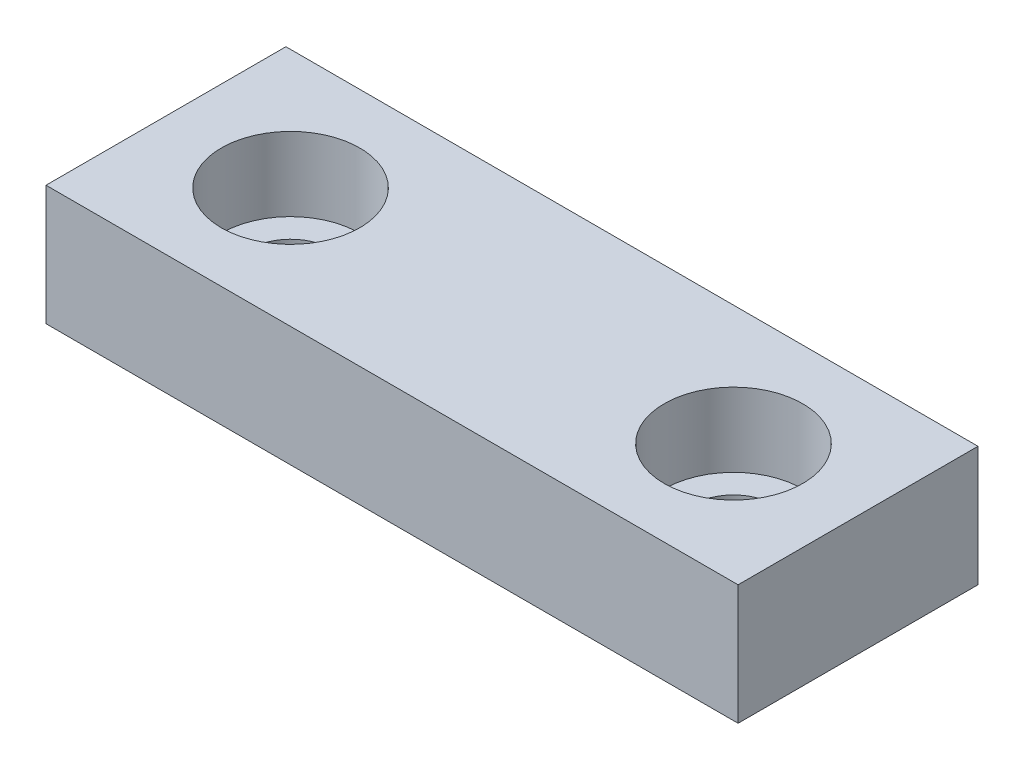
from build123d import *

# Parameters (mm, degrees)
SKETCH1_W                      = 75
SKETCH1_H                      = 26
EXTRUDE1_DEPTH                 = 13
CBORE_FOR_M8_SHCS1_D           = 9
CBORE_FOR_M8_SHCS1_CBORE_D     = 15
CBORE_FOR_M8_SHCS1_CBORE_DEPTH = 8


with BuildPart() as part:
    # Sketch1 → Extrude1 (new body)
    with BuildSketch(Plane(origin=(0, 0, 0), x_dir=(1, 0, 0), z_dir=(0, 1, 0))):
        Rectangle(SKETCH1_W, SKETCH1_H)
    extrude(amount=EXTRUDE1_DEPTH)

    # CBORE for M8 SHCS1 (through all)
    with Locations(Plane(origin=(0, 13, 0), x_dir=(-1, 0, 0), z_dir=(0, 1, 0))):
        with Locations((24, 0)):
            cbore_for_m8_shcs1 = CounterBoreHole(CBORE_FOR_M8_SHCS1_D / 2, CBORE_FOR_M8_SHCS1_CBORE_D / 2, CBORE_FOR_M8_SHCS1_CBORE_DEPTH)

    # Mirror1: CBORE for M8 SHCS1 across plane
    add(cbore_for_m8_shcs1.mirror(Plane(origin=(0, 0, 0), x_dir=(0, 0, 1), z_dir=(1, 0, 0))), mode=Mode.SUBTRACT)


solid = part.part
